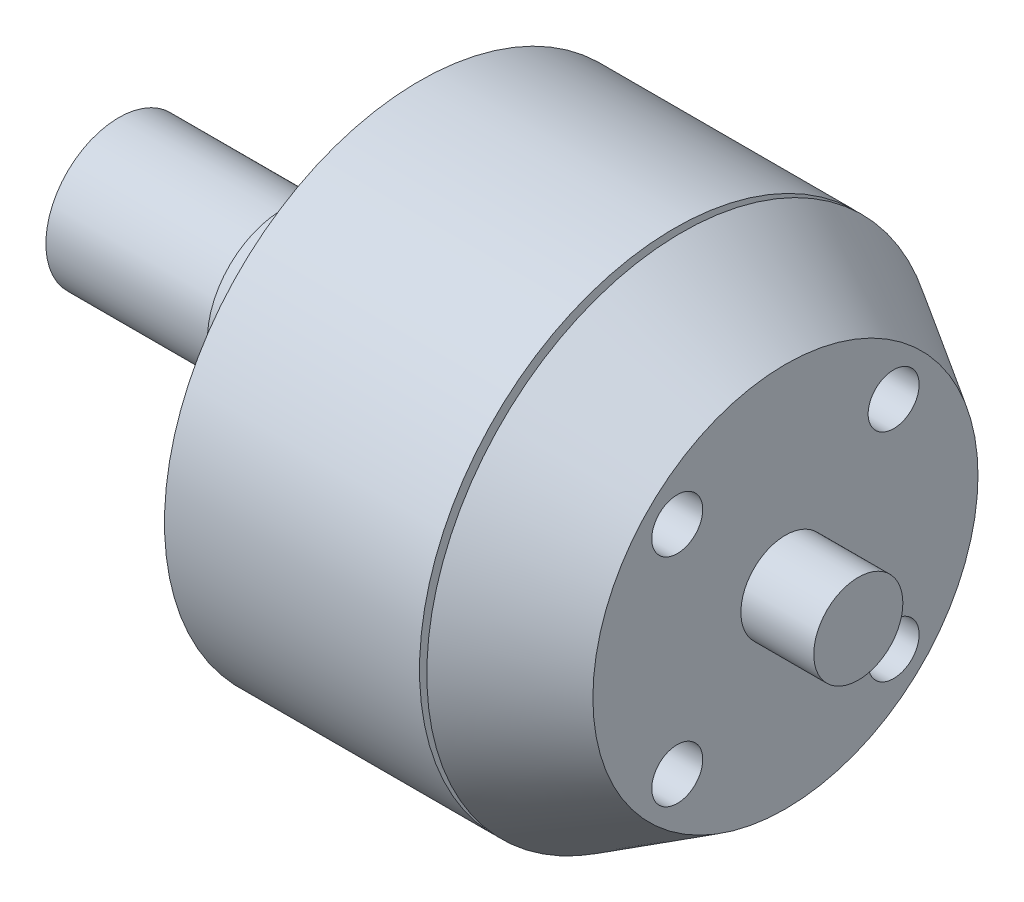
from build123d import *

# Parameters (mm, degrees)
SKETCH3_R          = 0.7
CUT_EXTRUDE1_DEPTH = 2


with BuildPart() as part:
    # Sketch2 → Revolve1 (revolve)
    with BuildSketch(Plane(origin=(0, 0, 0), x_dir=(1, 0, 0), z_dir=(0, 1, 0))):
        Polygon((-2.345452762, 2.067742112), (-2.345452762, 3), (-1.845452762, 3), (-0.089526495, 7), (6.910473505, 7), (6.910473505, 5.285375335), (7.110473505, 5.285375335), (7.110473505, 7), (9.954547238, 5.285375335), (9.954547238, 1.223141528), (11.954547238, 1.223141528), (11.954547238, 0), (-8.345452762, 0), (-8.345452762, 2), (-3.845452762, 2), (-3.845452762, 2.067742112), align=None)
    revolve(axis=Axis((11.954547238, 0, 0), (-1, 0, 0)))

    # Sketch3 → Cut-Extrude1 (cut)
    with BuildSketch(Plane(origin=(9.954547238, 0, 0), x_dir=(0, 0, -1), z_dir=(1, 0, 0))):
        with Locations((2.969848481, 2.969848481)):
            Circle(SKETCH3_R)
        with Locations((2.969848481, -2.969848481)):
            Circle(SKETCH3_R)
        with Locations((-2.969848481, -2.969848481)):
            Circle(SKETCH3_R)
        with Locations((-2.969848481, 2.969848481)):
            Circle(SKETCH3_R)
    extrude(amount=-CUT_EXTRUDE1_DEPTH, mode=Mode.SUBTRACT)


solid = part.part
